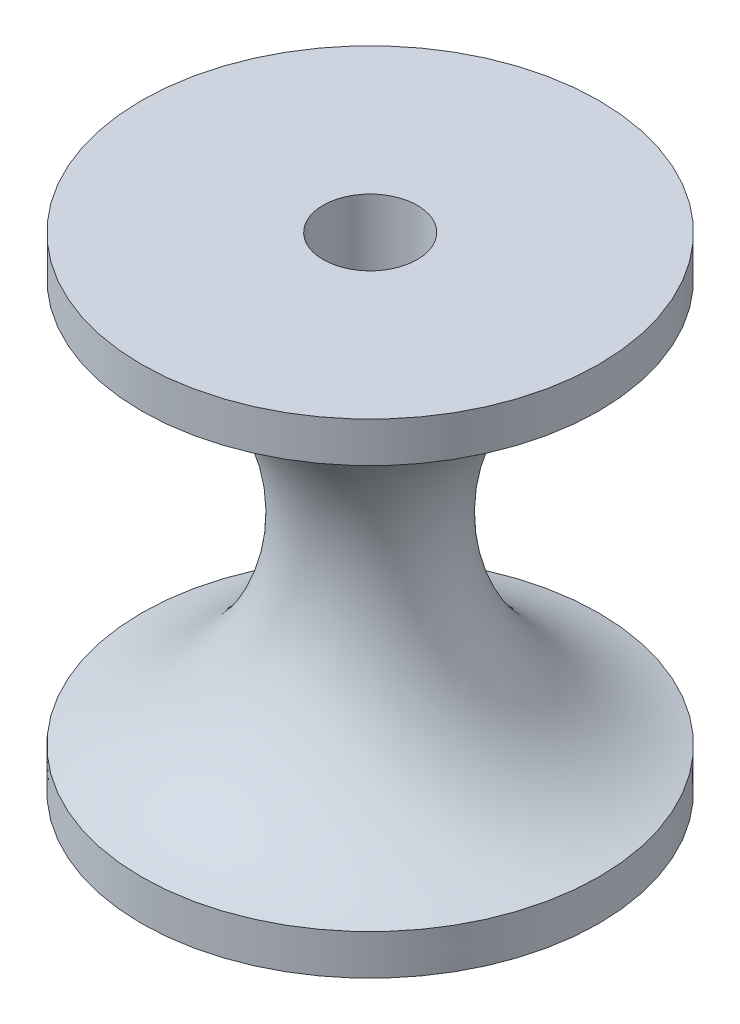
from build123d import *

# Parameters (mm, degrees)
CUT_EXTRUDE1_REACH = 45.29
SKETCH3_R          = 3.5


with BuildPart() as part:
    # Sketch1 → Revolve1 (revolve)
    with BuildSketch(Plane.XY, mode=Mode.PRIVATE) as revolve1_sk:
        with BuildLine():
            Line((0, 0), (0, 36))
            Line((0, 36), (-17, 36))
            Line((-17, 36), (-17, 33))
            ThreePointArc((-17, 33), (-5.475825304, 17.999955029), (-17.000086905, 2.999976826))
            Line((-17.000086905, 2.999976826), (-17, 0))
            Line((-17, 0), (0, 0))
        make_face()
    revolve(revolve1_sk.sketch.rotate(Axis((0, 0, 0), (0, 1, 0)), 270), axis=Axis((0, 0, 0), (0, 1, 0)))

    # Sketch3 → Cut-Extrude1 (cut, up to next)
    with BuildSketch(Plane(origin=(0, 36, 0), x_dir=(1, 0, 0), z_dir=(0, 1, 0)), mode=Mode.PRIVATE) as cut_extrude1_sk1:
        with Locations(Location((0, 0, 0), (0, 0, 270))):
            Circle(SKETCH3_R)
    cut_extrude1_tool1 = extrude(cut_extrude1_sk1.sketch, amount=-CUT_EXTRUDE1_REACH, mode=Mode.PRIVATE) & part.part
    add(cut_extrude1_tool1.solids().sort_by_distance((0, 36, 0))[0], mode=Mode.SUBTRACT)


solid = part.part
